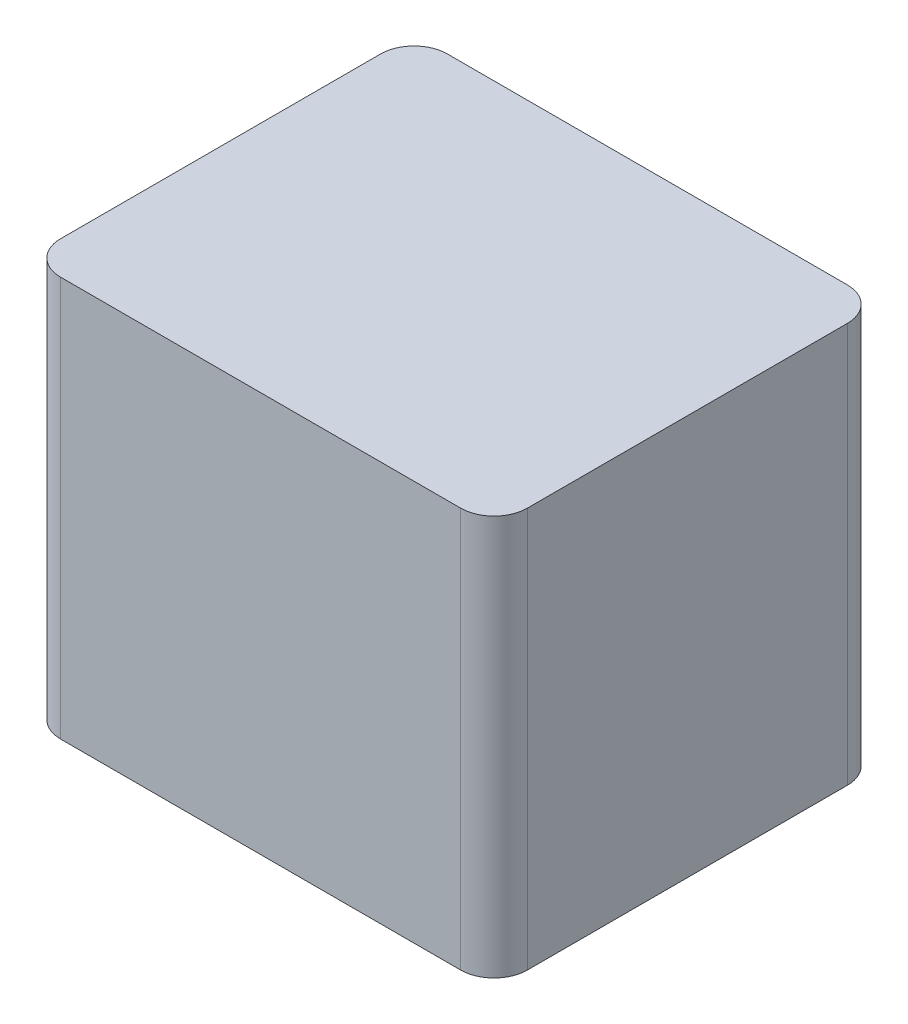
from build123d import *

# Parameters (mm, degrees)
BOSS_EXTRUDE1_DEPTH = 30


with BuildPart() as part:
    # Sketch1 → Boss-Extrude1 (new, symmetric)
    with BuildSketch(Plane(origin=(0, 0, 0), x_dir=(1, 0, 0), z_dir=(0, 1, 0))):
        with BuildLine():
            Line((-30, -29), (30, -29))
            ThreePointArc((30, -29), (33.535533906, -27.535533906), (35, -24))
            Line((35, -24), (35, 24))
            ThreePointArc((35, 24), (33.535533906, 27.535533906), (30, 29))
            Line((30, 29), (-30, 29))
            ThreePointArc((-30, 29), (-33.535533906, 27.535533906), (-35, 24))
            Line((-35, 24), (-35, -24))
            ThreePointArc((-35, -24), (-33.535533906, -27.535533906), (-30, -29))
        make_face()
    extrude(amount=BOSS_EXTRUDE1_DEPTH, both=True)


solid = part.part
